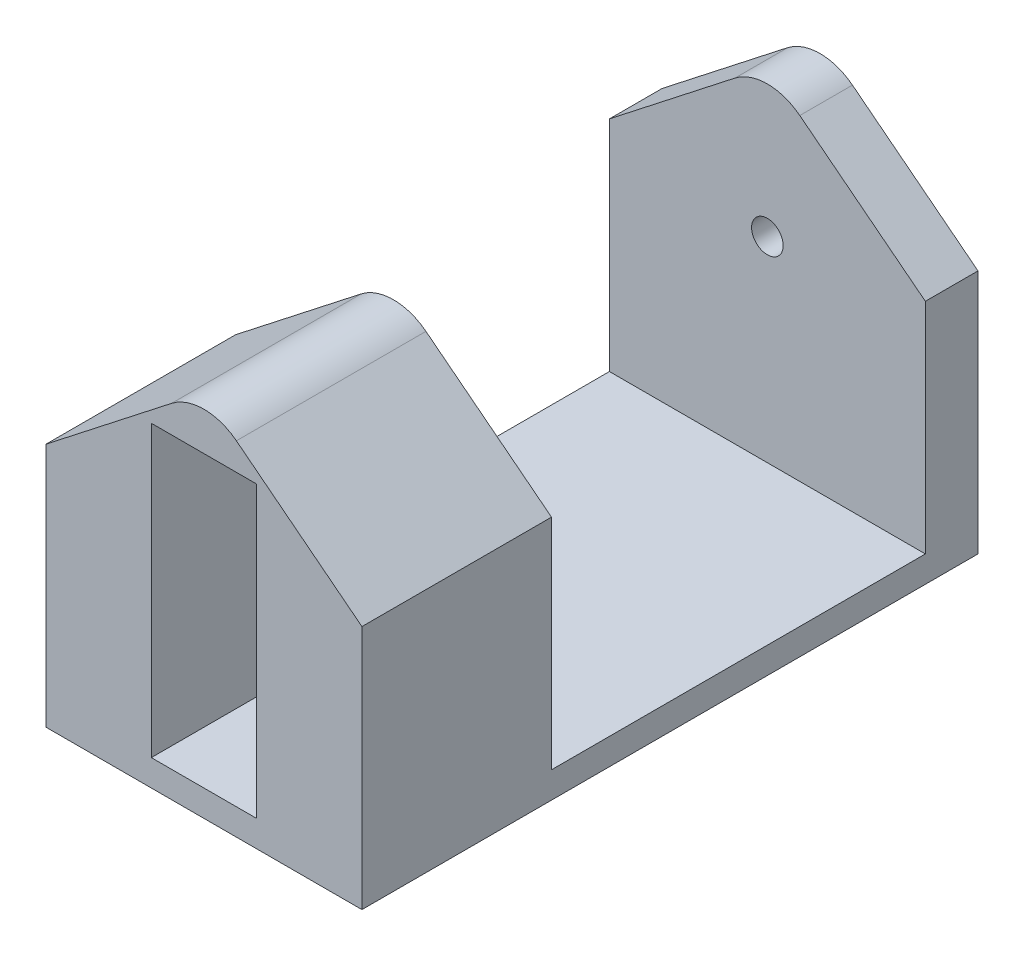
from build123d import *

# Parameters (mm, degrees)
SKETCH2_W           = 80
SKETCH2_H           = 117
BOSS_EXTRUDE1_DEPTH = 70
SKETCH3_W           = 80
SKETCH3_H           = 71
CUT_EXTRUDE1_DEPTH  = 65
SKETCH4_W           = 20
SKETCH4_H           = 55
CUT_EXTRUDE2_DEPTH  = 65
CUT_EXTRUDE3_DEPTH  = 143.088000901
SKETCH6_R           = 3
CUT_EXTRUDE4_DEPTH  = 65
SKETCH8_W           = 10
SKETCH8_H           = 117
CUT_EXTRUDE5_DEPTH  = 98.731980436


with BuildPart() as part:
    # Sketch2 → Boss-Extrude1 (new body)
    with BuildSketch(Plane(origin=(0, 0, 0), x_dir=(1, 0, 0), z_dir=(0, 1, 0))):
        Rectangle(SKETCH2_W, SKETCH2_H)
    extrude(amount=BOSS_EXTRUDE1_DEPTH)

    # Sketch3 → Cut-Extrude1 (cut)
    with BuildSketch(Plane(origin=(0, 70, 0), x_dir=(1, 0, 0), z_dir=(0, 1, 0))):
        with Locations((0, 13)):
            Rectangle(SKETCH3_W, SKETCH3_H)
    extrude(amount=-CUT_EXTRUDE1_DEPTH, mode=Mode.SUBTRACT)

    # Sketch4 → Cut-Extrude2 (cut)
    with BuildSketch(Plane.XY.offset(58.5)):
        with Locations((0, 32.5)):
            Rectangle(SKETCH4_W, SKETCH4_H)
    extrude(amount=-CUT_EXTRUDE2_DEPTH, mode=Mode.SUBTRACT)

    # Sketch5 → Cut-Extrude3 (cut, through all)
    with BuildSketch(Plane.XY.offset(58.5)):
        with BuildLine():
            Line((-6.157789331, 65.187529324), (-40, 38.738971621))
            Line((-40, 38.738971621), (-40, 70))
            Line((-40, 70), (40, 70))
            Line((40, 70), (40, 38.738971621))
            Line((40, 38.738971621), (6.157789331, 65.187529324))
            ThreePointArc((6.157789331, 65.187529324), (0, 67.30833961), (-6.157789331, 65.187529324))
        make_face()
    extrude(amount=-CUT_EXTRUDE3_DEPTH, mode=Mode.SUBTRACT)

    # Sketch6 → Cut-Extrude4 (cut)
    with BuildSketch(Plane.XY.offset(-48.5)):
        with Locations((0, 42.2)):
            Circle(SKETCH6_R)
    extrude(amount=-CUT_EXTRUDE4_DEPTH, mode=Mode.SUBTRACT)

    # Sketch8 → Cut-Extrude5 (cut, through all)
    with BuildSketch(Plane(origin=(0, 67.3, 0), x_dir=(1, 0, 0), z_dir=(0, 1, 0))):
        with Locations((-35, 0)):
            Rectangle(SKETCH8_W, SKETCH8_H)
        with Locations((35, 0)):
            Rectangle(SKETCH8_W, SKETCH8_H)
    extrude(amount=-CUT_EXTRUDE5_DEPTH, mode=Mode.SUBTRACT)


solid = part.part
